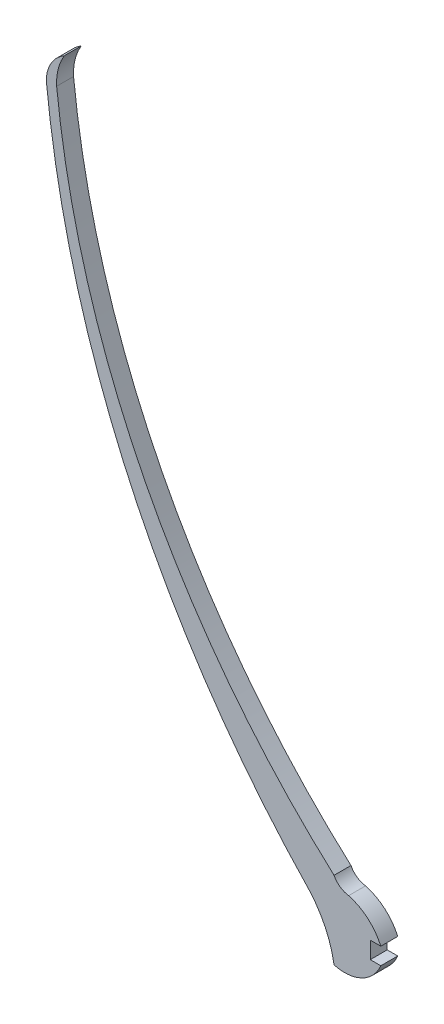
from build123d import *

# Parameters (mm, degrees)
BOSS_EXTRUDE1_DEPTH = 1.524


with BuildPart() as part:
    # Sketch1 → Boss-Extrude1 (new body)
    with BuildSketch(Plane.XY):
        with BuildLine():
            Line((-12.390496283, 0), (-12.390496283, -1.524))
            Line((-12.390496283, -1.524), (-11.440495099, -1.524))
            ThreePointArc((-11.440495099, -1.524), (-13.160567298, -3.340075702), (-15.652172906, -3.560713016))
            ThreePointArc((-15.652172906, -3.560713016), (-16.43578107, -1.039818757), (-17.898233983, 1.157948542))
            ThreePointArc((-17.898233983, 1.157948542), (-34.014860834, 24.840522989), (-41.571298491, 52.472212106))
            ThreePointArc((-41.571298491, 52.472212106), (-41.120011165, 54.045320934), (-39.952895072, 55.192566182))
            ThreePointArc((-39.952895072, 55.192566182), (-40.500139361, 53.88401522), (-40.636498822, 52.472212106))
            ThreePointArc((-40.636498822, 52.472212106), (-32.67469804, 25.640883384), (-15.652172906, 3.425030694))
            ThreePointArc((-15.652172906, 3.425030694), (-15.109824899, 2.798358256), (-14.338010517, 2.496427364))
            ThreePointArc((-14.338010517, 2.496427364), (-12.609091081, 1.573387542), (-11.440495099, 0))
            Line((-11.440495099, 0), (-12.390496283, 0))
        make_face()
    extrude(amount=BOSS_EXTRUDE1_DEPTH)


solid = part.part
